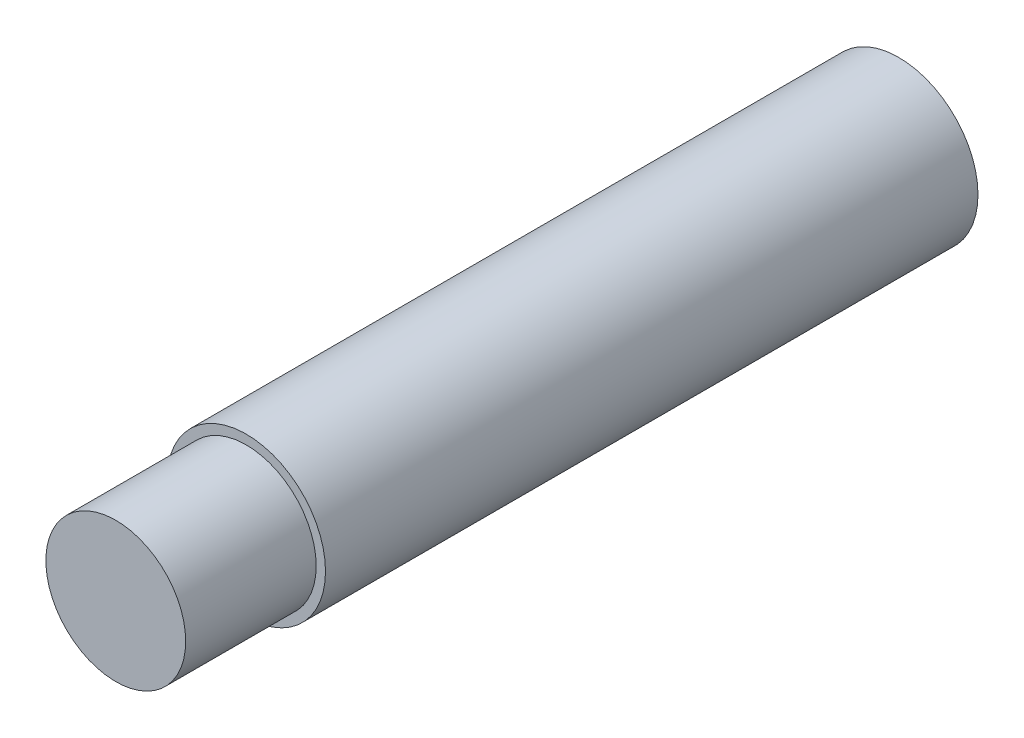
from build123d import *

# Parameters (mm, degrees)
SKETCH2_R                = 4.25
BOSS_EXTRUDE1_DEPTH      = 35
BOSS_EXTRUDE2_DEPTH      = 7
BOSS_EXTRUDE2_DEPTH_BACK = 29.5
SKETCH3_R                = 3.75


with BuildPart() as part:
    # Sketch2 → Boss-Extrude1 (new body)
    with BuildSketch(Plane.XY):
        Circle(SKETCH2_R)
    extrude(amount=BOSS_EXTRUDE1_DEPTH)

    # Sketch3 → Boss-Extrude2 (add, two sides: drawn at the far end of the back side and taken through both)
    with BuildSketch(Plane.XY.offset(35).offset(-BOSS_EXTRUDE2_DEPTH_BACK)):
        Circle(SKETCH3_R)
    extrude(amount=BOSS_EXTRUDE2_DEPTH + BOSS_EXTRUDE2_DEPTH_BACK)


solid = part.part
